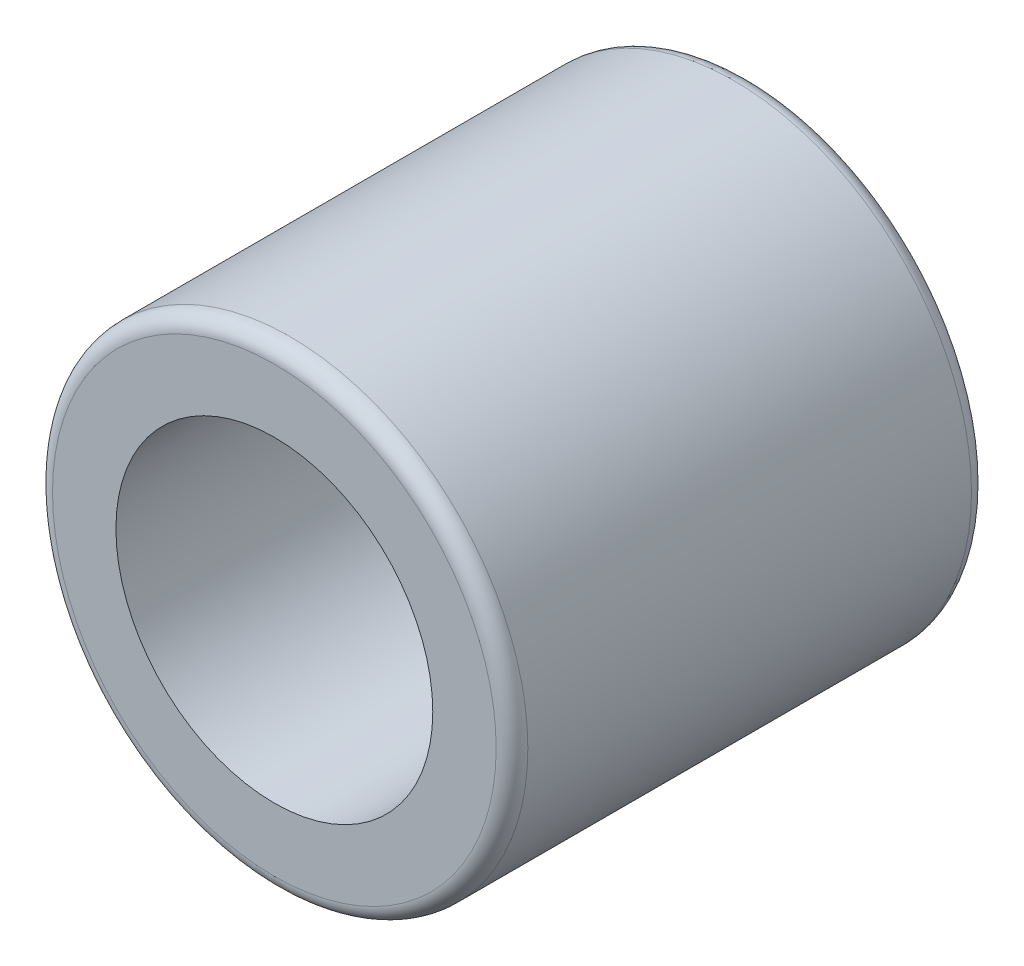
from build123d import *

# Parameters (mm, degrees)
SKETCH1_R           = 15
SKETCH1_R_2         = 10
BOSS_EXTRUDE1_DEPTH = 30
FILLET1_R           = 1


with BuildPart() as part:
    # Sketch1 → Boss-Extrude1 (new body)
    with BuildSketch(Plane.XY):
        Circle(SKETCH1_R)
        Circle(SKETCH1_R_2, mode=Mode.SUBTRACT)
    extrude(amount=BOSS_EXTRUDE1_DEPTH)

    # Fillet1
    fillet1_edges = [part.edges().sort_by_distance(p)[0] for p in [
        (-15, 0, 0),
        (-15, 0, 30),
    ]]
    fillet(fillet1_edges, radius=FILLET1_R)


solid = part.part
